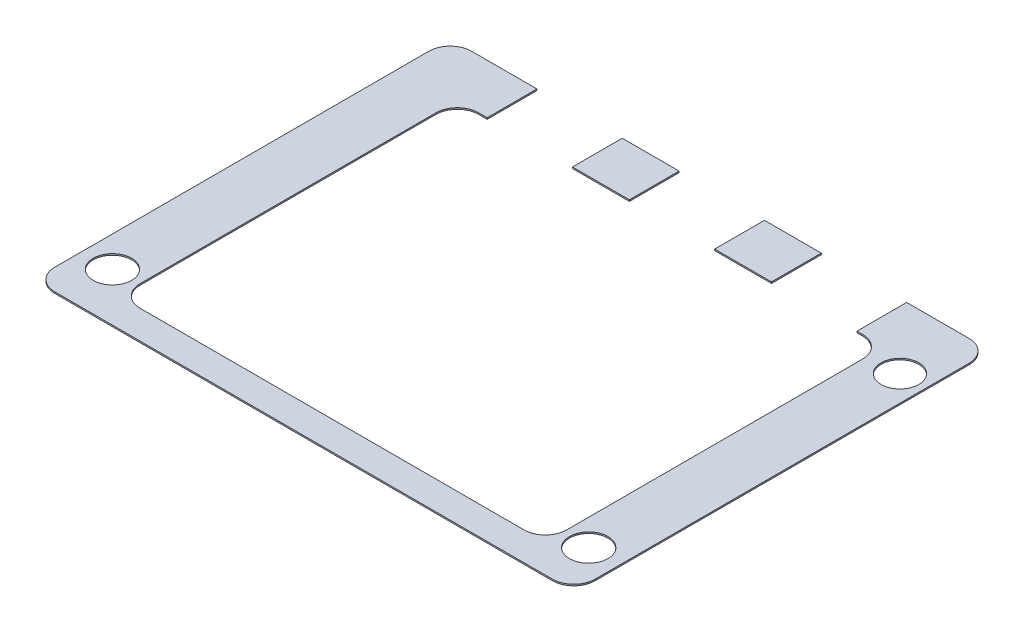
from build123d import *

# Parameters (mm, degrees)
BOSS_EXTRUDE1_DEPTH = 0.2
SKETCH4_W           = 12.007758181
SKETCH4_H           = 0.2
SKETCH4_W_2         = 12.001595936
SKETCH4_W_3         = 12
CUT_EXTRUDE3_DEPTH  = 7
SKETCH5_R           = 2.65
CUT_EXTRUDE4_DEPTH  = 96.980958528
SKETCH6_R           = 2.7
CUT_EXTRUDE5_DEPTH  = 96.980958528
SKETCH7_R           = 2.7
CUT_EXTRUDE6_DEPTH  = 96.980958528


with BuildPart() as part:
    # Sketch1 → Boss-Extrude1 (new body)
    with BuildSketch(Plane(origin=(0, 0, 0), x_dir=(1, 0, 0), z_dir=(0, 1, 0))):
        with BuildLine():
            Line((3, 0), (73, 0))
            ThreePointArc((73, 0), (75.121320344, 0.878679656), (76, 3))
            Line((76, 3), (76, 52.62))
            Line((76, 52.62), (76, 55.62))
            ThreePointArc((76, 55.62), (75.121320344, 57.741320344), (73, 58.62))
            Line((73, 58.62), (3, 58.62))
            ThreePointArc((3, 58.62), (0.878679656, 57.741320344), (0, 55.62))
            Line((0, 55.62), (0, 52.62))
            Line((0, 52.62), (0, 3))
            ThreePointArc((0, 3), (0.878679656, 0.878679656), (3, 0))
        make_face()
        with BuildLine():
            Line((11, 4), (65, 4))
            ThreePointArc((65, 4), (67.121320344, 4.878679656), (68, 7))
            Line((68, 7), (68, 48.62))
            ThreePointArc((68, 48.62), (67.121320344, 50.741320344), (65, 51.62))
            Line((65, 51.62), (11, 51.62))
            ThreePointArc((11, 51.62), (8.878679656, 50.741320344), (8, 48.62))
            Line((8, 48.62), (8, 7))
            ThreePointArc((8, 7), (8.878679656, 4.878679656), (11, 4))
        make_face(mode=Mode.SUBTRACT)
    extrude(amount=BOSS_EXTRUDE1_DEPTH)

    # Sketch4 → Cut-Extrude3 (cut)
    with BuildSketch(Plane(origin=(0, 0, -58.62), x_dir=(-1, 0, 0), z_dir=(0, 0, -1))):
        with Locations((-58.19612091, 0.1)):
            Rectangle(SKETCH4_W, SKETCH4_H)
        with Locations((-38.199202032, 0.1)):
            Rectangle(SKETCH4_W_2, SKETCH4_H)
        with Locations((-18.2, 0.1)):
            Rectangle(SKETCH4_W_3, SKETCH4_H)
    extrude(amount=-CUT_EXTRUDE3_DEPTH, mode=Mode.SUBTRACT)


with BuildPart() as cut_extrude3_piece_1:
    # of the separate pieces the step leaves, piece 1, a body of its own (cut_extrude3_pieces)
    add(part.part.solids().sort_by_distance((3, 0, 0))[0])

    # Sketch5 → Cut-Extrude4 (cut, through all)
    with BuildSketch(Plane(origin=(0, 0, 0), x_dir=(-1, 0, 0), z_dir=(0, -1, 0))):
        with Locations(Location((-72.402273283, 49.4772806, 0), (0, 0, 90))):
            Circle(SKETCH5_R)
    extrude(amount=-CUT_EXTRUDE4_DEPTH, mode=Mode.SUBTRACT)

    # Sketch6 → Cut-Extrude5 (cut, through all)
    with BuildSketch(Plane(origin=(0, 0, 0), x_dir=(-1, 0, 0), z_dir=(0, -1, 0))):
        with Locations(Location((-4.310637365, 6.802083571, 0), (0, 0, 90))):
            Circle(SKETCH6_R)
    extrude(amount=-CUT_EXTRUDE5_DEPTH, mode=Mode.SUBTRACT)

    # Sketch7 → Cut-Extrude6 (cut, through all)
    with BuildSketch(Plane(origin=(0, 0, 0), x_dir=(-1, 0, 0), z_dir=(0, -1, 0))):
        with Locations(Location((-71.7, 6.4, 0), (0, 0, 90))):
            Circle(SKETCH7_R)
    extrude(amount=-CUT_EXTRUDE6_DEPTH, mode=Mode.SUBTRACT)


with BuildPart() as cut_extrude3_piece_2:
    # of the separate pieces the step leaves, piece 2, a body of its own (cut_extrude3_pieces)
    add(part.part.solids().sort_by_distance((32.198404064, 0, -58.62))[0])


with BuildPart() as cut_extrude3_piece_3:
    # of the separate pieces the step leaves, piece 3, a body of its own (cut_extrude3_pieces)
    add(part.part.solids().sort_by_distance((52.192241819, 0, -58.62))[0])


solid = Compound([cut_extrude3_piece_1.part, cut_extrude3_piece_2.part, cut_extrude3_piece_3.part])
